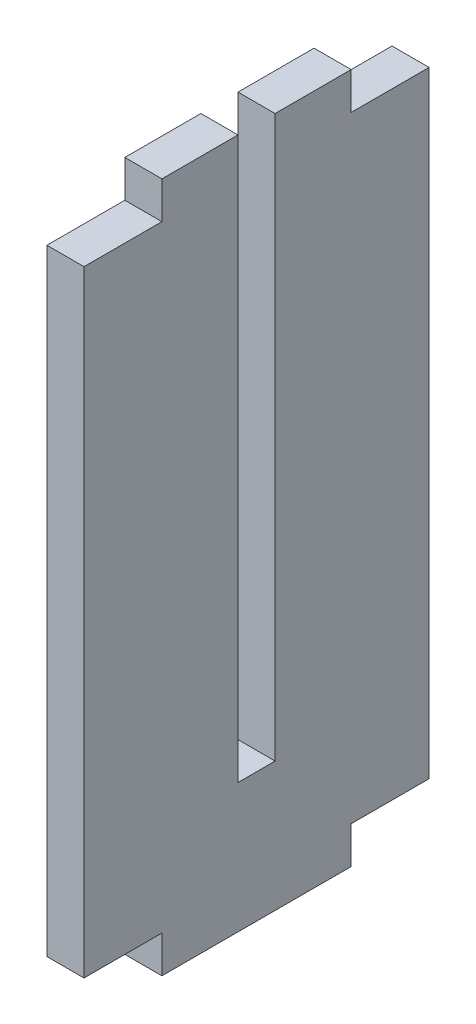
from build123d import *

# Parameters (mm, degrees)
SKETCH1_W           = 50.8
SKETCH1_H           = 101.6
BOSS_EXTRUDE1_DEPTH = 5.461
SKETCH2_W           = 11.472333333
SKETCH2_H           = 5.461
SKETCH2_W_2         = 5.461
SKETCH2_H_2         = 82.55
CUT_EXTRUDE1_DEPTH  = 5.461


with BuildPart() as part:
    # Sketch1 → Boss-Extrude1 (new body)
    with BuildSketch(Plane(origin=(0, 0, 0), x_dir=(0, 0, -1), z_dir=(1, 0, 0))):
        with Locations((25.4, 50.8)):
            Rectangle(SKETCH1_W, SKETCH1_H)
    extrude(amount=BOSS_EXTRUDE1_DEPTH)

    # Sketch2 → Cut-Extrude1 (cut)
    with BuildSketch(Plane(origin=(5.461, 0, 0), x_dir=(0, 0, -1), z_dir=(1, 0, 0))):
        with Locations((45.063833333, 98.8695)):
            Rectangle(SKETCH2_W, SKETCH2_H)
        with Locations((25.4, 60.325)):
            Rectangle(SKETCH2_W_2, SKETCH2_H_2)
        with Locations((5.736166666, 98.8695)):
            Rectangle(SKETCH2_W, SKETCH2_H)
        with Locations((45.063833333, 2.7305)):
            Rectangle(SKETCH2_W, SKETCH2_H)
        with Locations((5.736166666, 2.7305)):
            Rectangle(SKETCH2_W, SKETCH2_H)
    extrude(amount=-CUT_EXTRUDE1_DEPTH, mode=Mode.SUBTRACT)


solid = part.part
